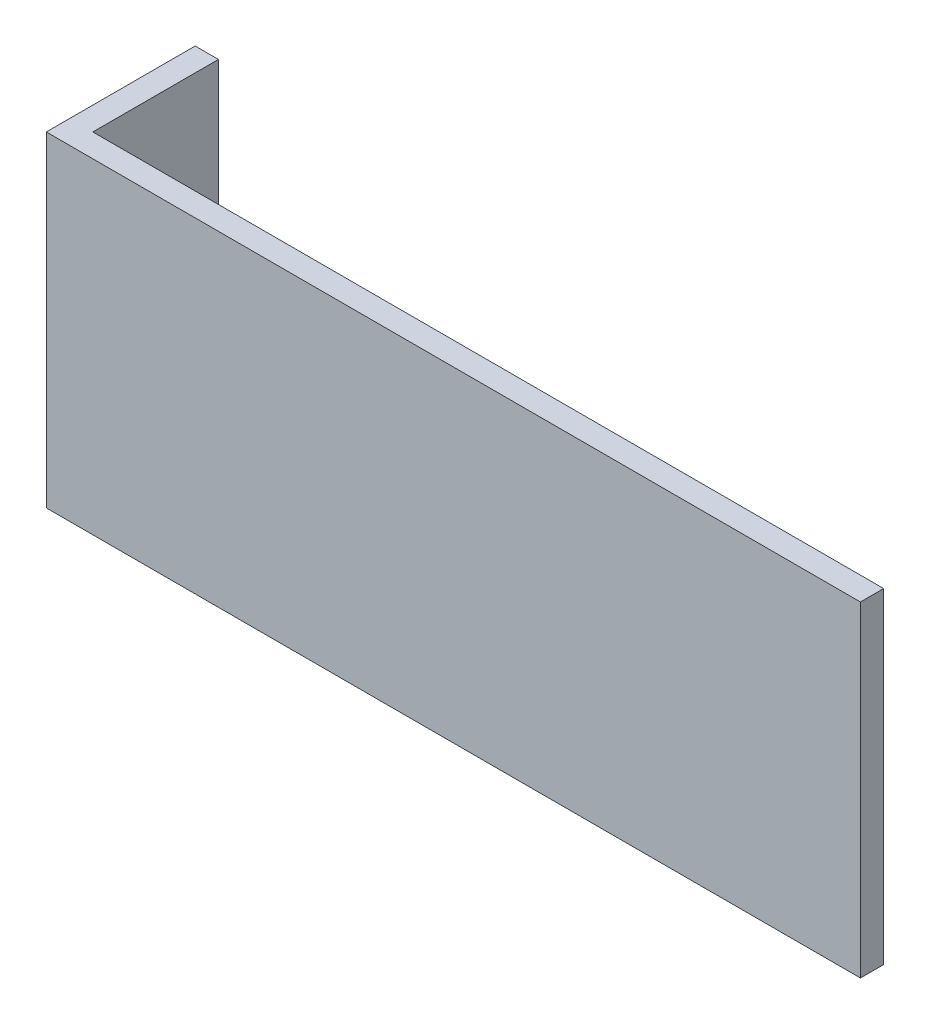
from build123d import *

# Parameters (mm, degrees)
SKETCH2_W           = 170
SKETCH2_H           = 5
BOSS_EXTRUDE1_DEPTH = 70


with BuildPart() as part:
    # Sketch2 → Boss-Extrude1 (new body)
    with BuildSketch(Plane(origin=(0, 0, 0), x_dir=(1, 0, 0), z_dir=(0, 1, 0))):
        with Locations((85, 2.5)):
            Rectangle(SKETCH2_W, SKETCH2_H)
        Polygon((-5, 0), (0, 0), (0, 5), (0, 32), (-5, 32), align=None)
    extrude(amount=BOSS_EXTRUDE1_DEPTH)


solid = part.part
